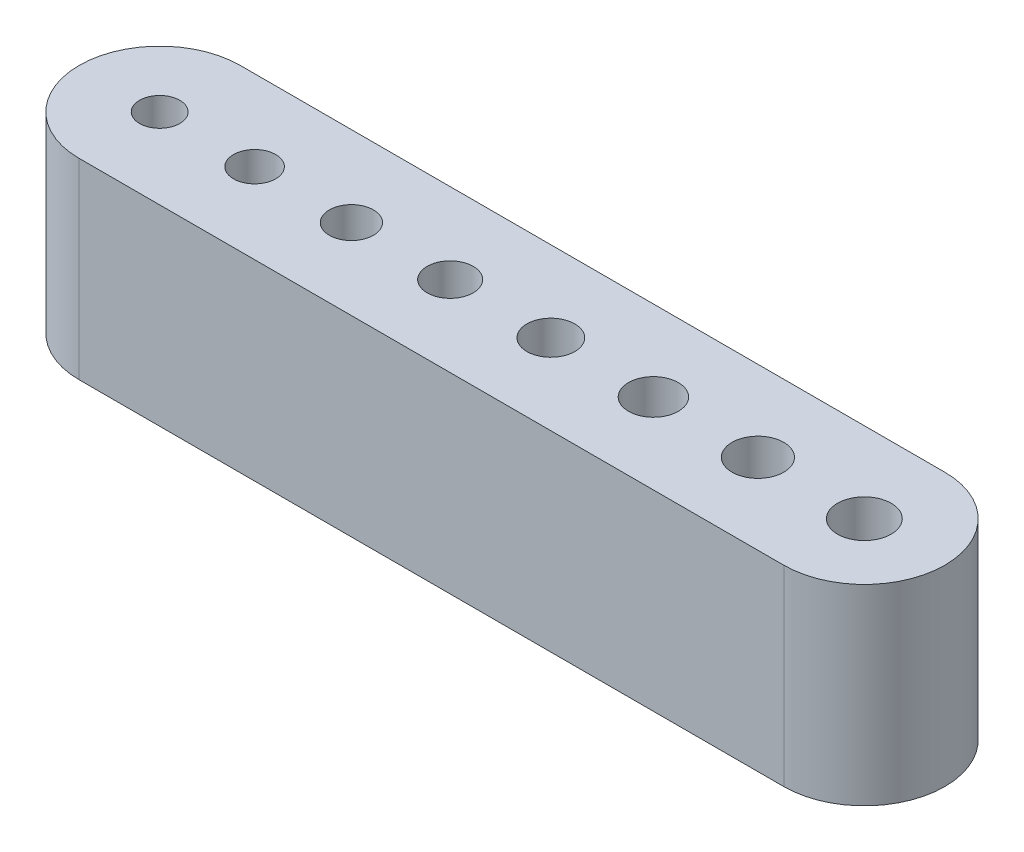
from build123d import *

# Parameters (mm, degrees)
SKETCH1_R           = 1.05
SKETCH1_R_2         = 1.1
SKETCH1_R_3         = 1.15
SKETCH1_R_4         = 1.2
SKETCH1_R_5         = 1.25
SKETCH1_R_6         = 1.4
SKETCH1_R_7         = 1.3
SKETCH1_R_8         = 1.35
BOSS_EXTRUDE1_DEPTH = 10


with BuildPart() as part:
    # Sketch1 → Boss-Extrude1 (new body)
    with BuildSketch(Plane(origin=(0, 0, 0), x_dir=(1, 0, 0), z_dir=(0, 1, 0))):
        with BuildLine():
            Line((-18.375, 4.2), (18.375, 4.2))
            ThreePointArc((18.375, 4.2), (22.575, 0), (18.375, -4.2))
            Line((18.375, -4.2), (-18.375, -4.2))
            ThreePointArc((-18.375, -4.2), (-22.575, 0), (-18.375, 4.2))
        make_face()
        with Locations(Location((-18.375, 0, 0), (0, 0, 270))):
            Circle(SKETCH1_R, mode=Mode.SUBTRACT)
        with Locations(Location((-13.425, 0, 0), (0, 0, 270))):
            Circle(SKETCH1_R_2, mode=Mode.SUBTRACT)
        with Locations(Location((-8.375, 0, 0), (0, 0, 270))):
            Circle(SKETCH1_R_3, mode=Mode.SUBTRACT)
        with Locations(Location((-3.225, 0, 0), (0, 0, 270))):
            Circle(SKETCH1_R_4, mode=Mode.SUBTRACT)
        with Locations(Location((2.025, 0, 0), (0, 0, 270))):
            Circle(SKETCH1_R_5, mode=Mode.SUBTRACT)
        with Locations(Location((18.375, 0, 0), (0, 0, 270))):
            Circle(SKETCH1_R_6, mode=Mode.SUBTRACT)
        with Locations(Location((7.375, 0, 0), (0, 0, 270))):
            Circle(SKETCH1_R_7, mode=Mode.SUBTRACT)
        with Locations(Location((12.825, 0, 0), (0, 0, 270))):
            Circle(SKETCH1_R_8, mode=Mode.SUBTRACT)
    extrude(amount=BOSS_EXTRUDE1_DEPTH)


solid = part.part
